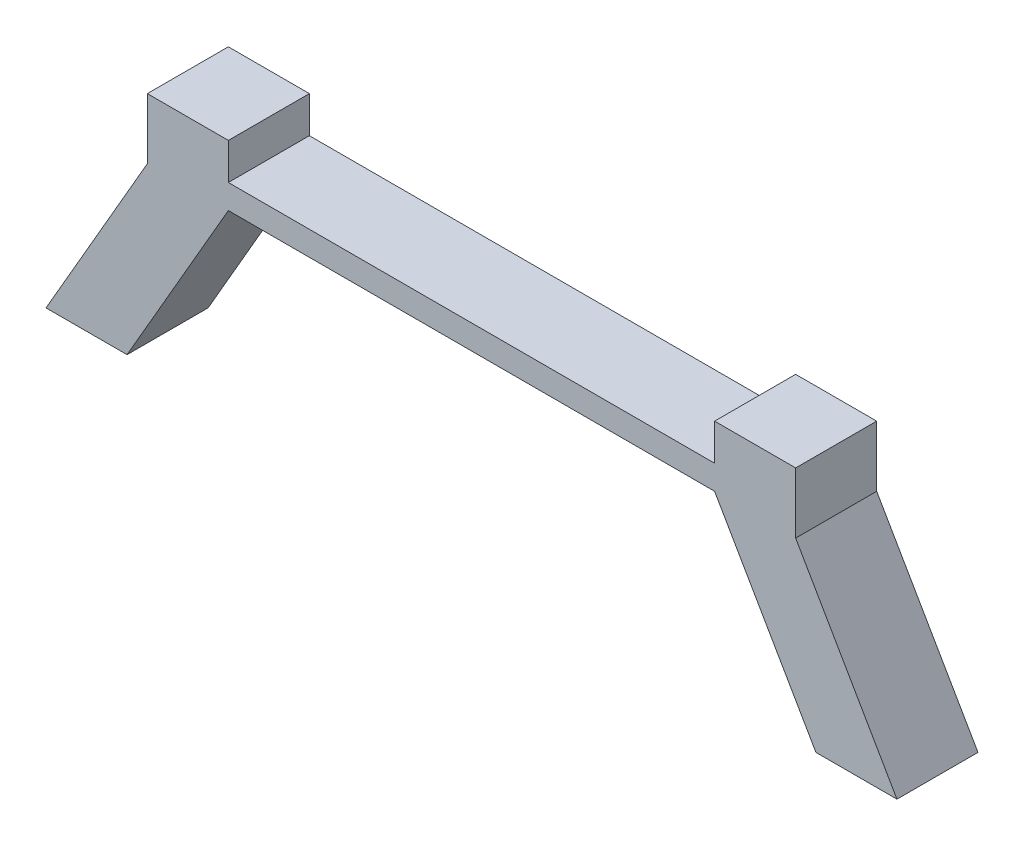
from build123d import *

# Parameters (mm, degrees)
SKETCH_1_W          = 160
SKETCH_1_H          = 20
EXTRUDE_1_DEPTH     = 15
SKETCH_2_W          = 120
SKETCH_2_H          = 20
CUT_EXTRUDE_1_DEPTH = 9
EXTRUDE_2_DEPTH     = 20


with BuildPart() as part:
    # 草图1 → 凸台-拉伸1 (new body)
    with BuildSketch(Plane(origin=(0, 0, 0), x_dir=(1, 0, 0), z_dir=(0, 1, 0))):
        with Locations((80, 10)):
            Rectangle(SKETCH_1_W, SKETCH_1_H)
    extrude(amount=EXTRUDE_1_DEPTH)

    # 草图2 → 切除-拉伸1 (cut)
    with BuildSketch(Plane(origin=(0, 15, 0), x_dir=(1, 0, 0), z_dir=(0, 1, 0))):
        with Locations((80, 10)):
            Rectangle(SKETCH_2_W, SKETCH_2_H)
    extrude(amount=-CUT_EXTRUDE_1_DEPTH, mode=Mode.SUBTRACT)

    # 草图4 → 凸台-拉伸2 (add)
    with BuildSketch(Plane.XY):
        Polygon((0, 0), (-25, -43.301270189), (-5, -43.301270189), (20, 0), align=None)
        Polygon((165, -43.301270189), (140, 0), (160, 0), (185, -43.301270189), align=None)
    extrude(amount=-EXTRUDE_2_DEPTH)


solid = part.part
